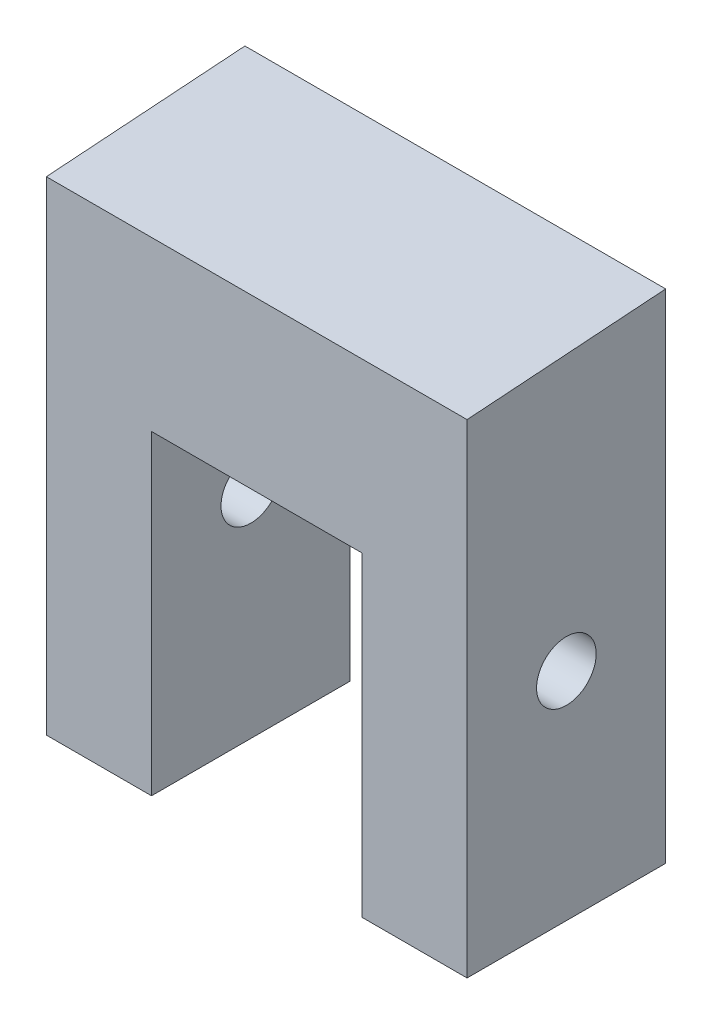
from build123d import *

# Parameters (mm, degrees)
BOSS_EXTRUDE1_DEPTH  = 25.4
SKETCH2_W            = 12.7
SKETCH2_H            = 19.05
CUT_EXTRUDE1_DEPTH   = 42.120060065
M3_CLEARANCE_HOLE1_D = 3.6


with BuildPart() as part:
    # Sketch1 → Boss-Extrude1 (new body)
    with BuildSketch(Plane(origin=(0, 0, 0), x_dir=(0, 0, -1), z_dir=(1, 0, 0))):
        Polygon((0, 0), (11.9888, 0), (11.9888, 30.032782328), (0, 29.194443765), align=None)
    extrude(amount=BOSS_EXTRUDE1_DEPTH)

    # Sketch2 → Cut-Extrude1 (cut, through all)
    with BuildSketch(Plane.XY):
        with Locations((12.7, 9.525)):
            Rectangle(SKETCH2_W, SKETCH2_H)
    extrude(amount=-CUT_EXTRUDE1_DEPTH, mode=Mode.SUBTRACT)

    # M3 Clearance Hole1 (through all)
    with Locations(Plane(origin=(25.4, 0, 0), x_dir=(0, 0, -1), z_dir=(1, 0, 0))):
        with Locations((5.9944, 13.0556)):
            Hole(M3_CLEARANCE_HOLE1_D / 2)


solid = part.part
